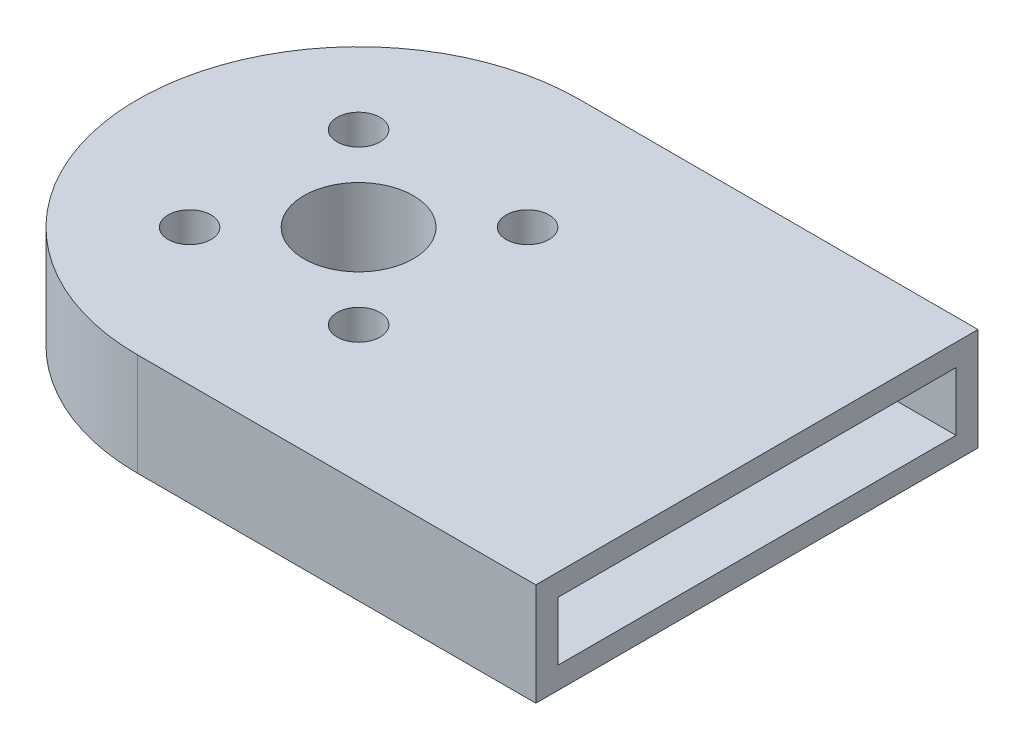
from build123d import *

# Parameters (mm, degrees)
SKETCH2_R           = 1.075
SKETCH2_R_2         = 2.75
BOSS_EXTRUDE1_DEPTH = 5.15
SHELL1_T            = -1.1


with BuildPart() as part:
    # Sketch2 → Boss-Extrude1 (new body)
    with BuildSketch(Plane(origin=(0, 0, 0), x_dir=(1, 0, 0), z_dir=(0, 1, 0))):
        with BuildLine():
            Line((0, 11.1), (20, 11.1))
            Line((20, 11.1), (20, -11.1))
            Line((20, -11.1), (0, -11.1))
            ThreePointArc((0, -11.1), (-11.1, 0), (0, 11.1))
        make_face()
        with Locations(Location((-4.242640687, 4.242640687, 0), (0, 0, 90))):
            Circle(SKETCH2_R, mode=Mode.SUBTRACT)
        with Locations(Location((4.242640687, 4.242640687, 0), (0, 0, 90))):
            Circle(SKETCH2_R, mode=Mode.SUBTRACT)
        with Locations(Location((-4.242640687, -4.242640687, 0), (0, 0, 90))):
            Circle(SKETCH2_R, mode=Mode.SUBTRACT)
        with Locations(Location((4.242640687, -4.242640687, 0), (0, 0, 90))):
            Circle(SKETCH2_R, mode=Mode.SUBTRACT)
        with Locations(Location((0, 0, 0), (0, 0, 90))):
            Circle(SKETCH2_R_2, mode=Mode.SUBTRACT)
    extrude(amount=BOSS_EXTRUDE1_DEPTH)

    # Shell1
    shell1_openings = [part.faces().sort_by_distance(p)[0] for p in [
        (20, 2.575, 0),
    ]]
    offset(amount=SHELL1_T, openings=shell1_openings)


solid = part.part
